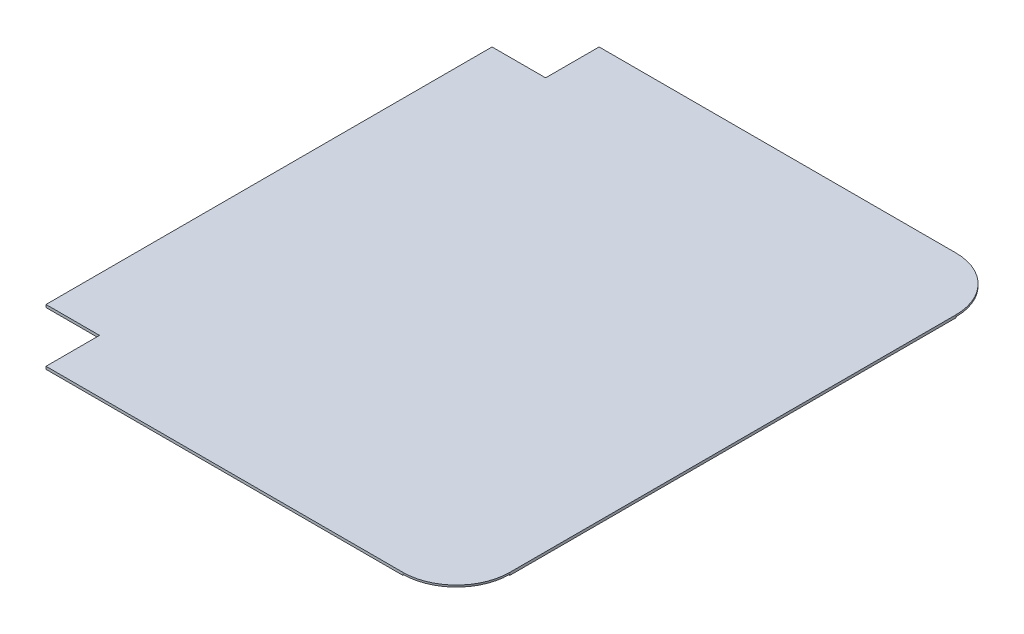
from build123d import *

# Parameters (mm, degrees)
EXTRUDE_1_DEPTH = 3
EXTRUDE_2_DEPTH = 2


with BuildPart() as part:
    # 草图1 → 凸台-拉伸1 (new body)
    with BuildSketch(Plane(origin=(0, 0, 0), x_dir=(1, 0, 0), z_dir=(0, 1, 0))):
        Polygon((-240.917431193, -196.788990826), (-240.917431193, -256.788990826), (159.082568807, -256.788990826), (159.082568807, -196.788990826), (219.082568807, -196.788990826), (219.082568807, 303.211009174), (159.082568807, 303.211009174), (159.082568807, 363.211009174), (-240.917431193, 363.211009174), (-240.917431193, 303.211009174), (-300.917431193, 303.211009174), (-300.917431193, -196.788990826), align=None)
    extrude(amount=EXTRUDE_1_DEPTH)

    # 草图2 → 凸台-拉伸2 (add)
    with BuildSketch(Plane(origin=(0, 3, 0), x_dir=(1, 0, 0), z_dir=(0, 1, 0))):
        with BuildLine():
            Line((159.082568807, 303.211009174), (219.082568807, 303.211009174))
            ThreePointArc((219.082568807, 303.211009174), (201.508975679, 345.637416046), (159.082568807, 363.211009174))
            Line((159.082568807, 363.211009174), (159.082568807, 303.211009174))
        make_face()
        with BuildLine():
            Line((159.082568807, -256.788990826), (159.082568807, -196.788990826))
            Line((159.082568807, -196.788990826), (219.082568807, -196.788990826))
            ThreePointArc((219.082568807, -196.788990826), (201.508975679, -239.215397697), (159.082568807, -256.788990826))
        make_face()
    extrude(amount=-EXTRUDE_2_DEPTH)


solid = part.part
